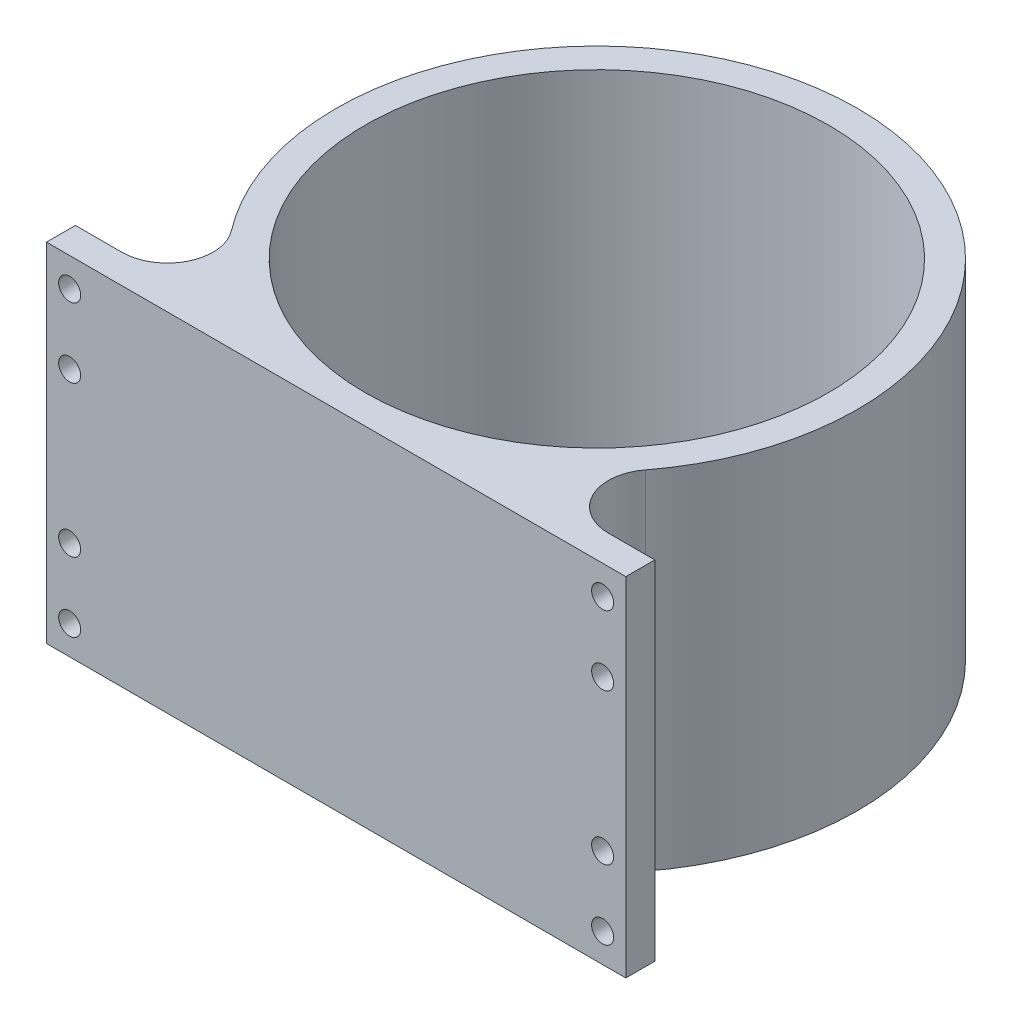
from build123d import *

# Parameters (mm, degrees)
SKETCH1_R           = 57.15
SKETCH1_R_2         = 50.8
BOSS_EXTRUDE1_DEPTH = 76.2
FILLET3_R           = 10
SKETCH2_R           = 2.413
CUT_EXTRUDE1_DEPTH  = 147.601134034


with BuildPart() as part:
    # Sketch1 → Boss-Extrude1 (new body)
    # profile 1 of 4: a face of its own
    with BuildSketch(Plane(origin=(0, 0, 0), x_dir=(1, 0, 0), z_dir=(0, 1, 0))):
        Circle(SKETCH1_R)
        with Locations(Location((0, 0, 0), (0, 0, 90))):
            Circle(SKETCH1_R_2, mode=Mode.SUBTRACT)
    # profile 2 of 4: a face of its own
    with BuildSketch(Plane(origin=(0, 0, 0), x_dir=(1, 0, 0), z_dir=(0, 1, 0))):
        with BuildLine():
            Line((-63.5, -57.15), (1.05e-07, -57.15))
            ThreePointArc((1.05e-07, -57.15), (-13.470384131, -55.539816811), (-26.181720723, -50.8))
            Line((-26.181720723, -50.8), (-63.5, -50.8))
            Line((-63.5, -50.8), (-63.5, -57.15))
        make_face()
    # profile 3 of 4: a face of its own
    with BuildSketch(Plane(origin=(0, 0, 0), x_dir=(1, 0, 0), z_dir=(0, 1, 0))):
        with BuildLine():
            ThreePointArc((-26.181720723, -50.8), (-13.470384131, -55.539816811), (1.05e-07, -57.15))
            ThreePointArc((1.05e-07, -57.15), (13.470384232, -55.539816786), (26.181720723, -50.8))
            Line((26.181720723, -50.8), (9.7e-08, -50.8))
            Line((9.7e-08, -50.8), (-26.181720723, -50.8))
        make_face()
    # profile 4 of 4: a face of its own
    with BuildSketch(Plane(origin=(0, 0, 0), x_dir=(1, 0, 0), z_dir=(0, 1, 0))):
        with BuildLine():
            Line((1.05e-07, -57.15), (63.5, -57.15))
            Line((63.5, -57.15), (63.5, -50.8))
            Line((63.5, -50.8), (26.181720723, -50.8))
            ThreePointArc((26.181720723, -50.8), (13.470384232, -55.539816786), (1.05e-07, -57.15))
        make_face()
    extrude(amount=BOSS_EXTRUDE1_DEPTH)

    # Fillet3
    fillet3_edges = [part.edges().sort_by_distance(p)[0] for p in [
        (26.181720723, 38.1, 50.8),
        (-26.181720723, 38.1, 50.8),
    ]]
    fillet(fillet3_edges, radius=FILLET3_R)

    # Sketch2 → Cut-Extrude1 (cut, through all)
    with BuildSketch(Plane(origin=(0, 0, 50.8), x_dir=(-1, 0, 0), z_dir=(0, 0, -1))):
        with Locations((58.416845051, 6.35)):
            Circle(SKETCH2_R)
        with Locations((58.416845051, 21.59)):
            Circle(SKETCH2_R)
        with Locations((58.416845051, 69.85)):
            Circle(SKETCH2_R)
        with Locations((58.416845051, 54.61)):
            Circle(SKETCH2_R)
        with Locations((-58.416845051, 6.35)):
            Circle(SKETCH2_R)
        with Locations((-58.416845051, 21.59)):
            Circle(SKETCH2_R)
        with Locations((-58.416845051, 69.85)):
            Circle(SKETCH2_R)
        with Locations((-58.416845051, 54.61)):
            Circle(SKETCH2_R)
    extrude(amount=-CUT_EXTRUDE1_DEPTH, mode=Mode.SUBTRACT)


solid = part.part
